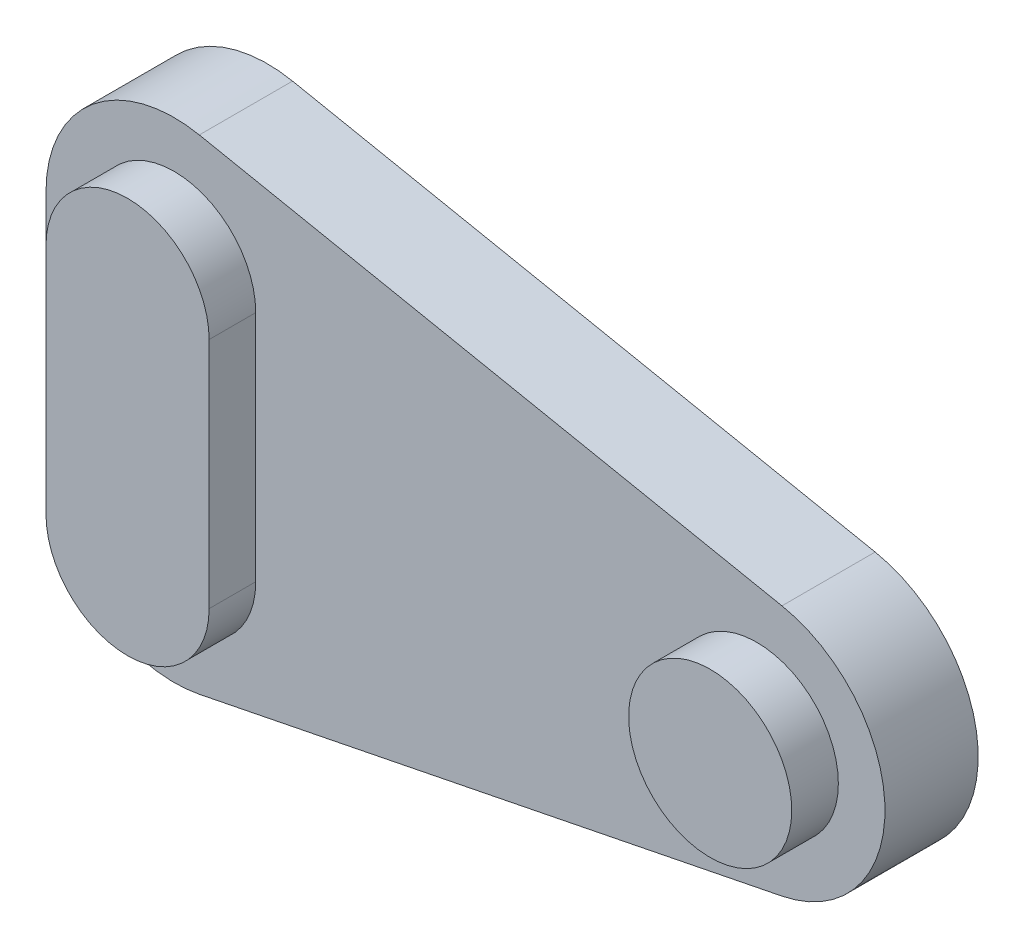
from build123d import *

# Parameters (mm, degrees)
BOSS_EXTRUDE3_DEPTH = 5.08
SKETCH6_W           = 8.89
SKETCH6_H           = 12.7
SKETCH6_R           = 4.445
BOSS_EXTRUDE4_DEPTH = 2.54


with BuildPart() as part:
    # Sketch1 → Boss-Extrude3 (new body)
    with BuildSketch(Plane.XY):
        with BuildLine():
            Line((0, 0), (0, 12.7))
            ThreePointArc((0, 12.7), (2.556587494, 18.101794857), (8.354871204, 19.54935602))
            Line((8.354871204, 19.54935602), (40.104871204, 13.19935602))
            ThreePointArc((40.104871204, 13.19935602), (45.72, 6.35), (40.104871204, -0.49935602))
            Line((40.104871204, -0.49935602), (8.354871204, -6.84935602))
            ThreePointArc((8.354871204, -6.84935602), (2.556587494, -5.401794857), (0, 0))
        make_face()
    extrude(amount=BOSS_EXTRUDE3_DEPTH)

    # Sketch6 → Boss-Extrude4 (add)
    with BuildSketch(Plane.XY.offset(5.08)):
        with BuildLine():
            ThreePointArc((2.54, 0), (6.985, -4.445), (11.43, 0))
            Line((11.43, 0), (2.54, 0))
        make_face()
        with Locations((6.985, 6.35)):
            Rectangle(SKETCH6_W, SKETCH6_H)
        with BuildLine():
            Line((2.54, 12.7), (11.43, 12.7))
            ThreePointArc((11.43, 12.7), (6.985, 17.145), (2.54, 12.7))
        make_face()
        with Locations((38.735, 6.35)):
            Circle(SKETCH6_R)
    extrude(amount=BOSS_EXTRUDE4_DEPTH)


solid = part.part
